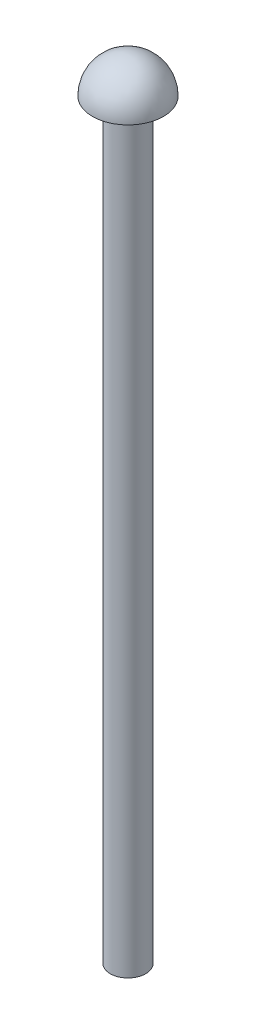
from build123d import *

# Parameters (mm, degrees)
SKETCH1_R           = 1.5
BOSS_EXTRUDE1_DEPTH = 63.5
REVOLVE1_ANGLE      = 180


with BuildPart() as part:
    # Sketch1 → Boss-Extrude1 (new body)
    with BuildSketch(Plane(origin=(0, 0, 0), x_dir=(1, 0, 0), z_dir=(0, 1, 0))):
        with Locations(Location((0, 0, 0), (0, 0, 270))):
            Circle(SKETCH1_R)
    extrude(amount=BOSS_EXTRUDE1_DEPTH)


with BuildPart() as body_2:
    # Sketch4 → Revolve1 (revolve)
    with BuildSketch(Plane(origin=(0, 63.5, 0), x_dir=(1, 0, 0), z_dir=(0, 1, 0))):
        with BuildLine():
            ThreePointArc((3, 0), (2.121320344, 2.121320344), (0, 3))
            Line((0, 3), (0, 1.5))
            ThreePointArc((0, 1.5), (1.060660172, 1.060660172), (1.5, 0))
            ThreePointArc((1.5, 0), (1.060660172, -1.060660172), (0, -1.5))
            Line((0, -1.5), (0, -3))
            ThreePointArc((0, -3), (2.121320344, -2.121320344), (3, 0))
        make_face()
    revolve(axis=Axis((0, 63.5, -3), (0, 0, 1)), revolution_arc=REVOLVE1_ANGLE)


solid = Compound([part.part, body_2.part])
